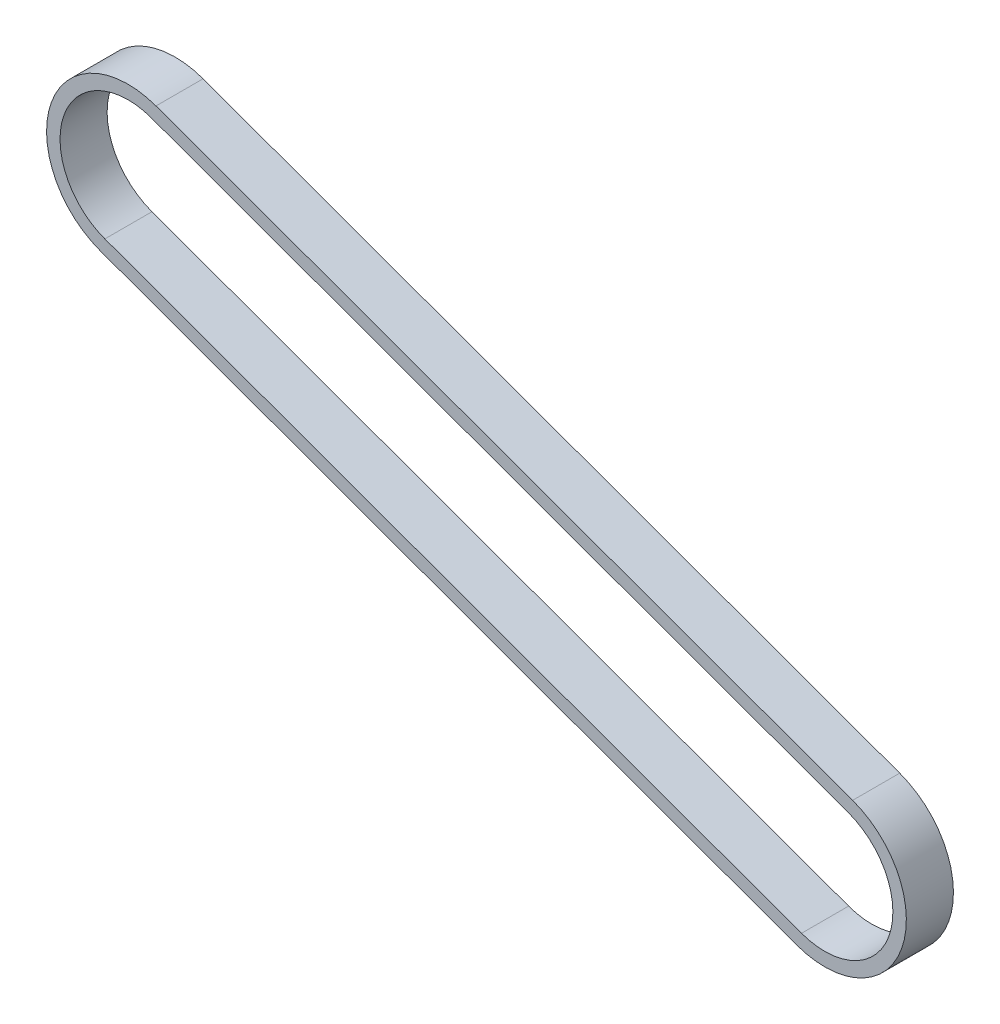
from build123d import *

# Parameters (mm, degrees)
EXTRUDE_1_DEPTH = 3.5


with BuildPart() as part:
    # 草图2 → 拉伸-薄壁1 (new, symmetric)
    with BuildSketch(Plane.XY):
        with BuildLine():
            Line((89.178412636, -49.011134366), (-14.39469241, -11.396709043))
            ThreePointArc((-14.39469241, -11.396709043), (-21.652482754, 4.138918699), (-6.116855012, 11.396709043))
            Line((-6.116855012, 11.396709043), (97.456250035, -26.217716281))
            ThreePointArc((97.456250035, -26.217716281), (104.714040378, -41.753344023), (89.178412636, -49.011134366))
        make_face()
        with BuildLine():
            Line((89.861120875, -47.131264834), (-13.711984171, -9.51683951))
            ThreePointArc((-13.711984171, -9.51683951), (-19.772613221, 3.45621046), (-6.799563251, 9.51683951))
            Line((-6.799563251, 9.51683951), (96.773541796, -28.097585814))
            ThreePointArc((96.773541796, -28.097585814), (102.834170845, -41.070635784), (89.861120875, -47.131264834))
        make_face(mode=Mode.SUBTRACT)
    extrude(amount=EXTRUDE_1_DEPTH, both=True)


solid = part.part
